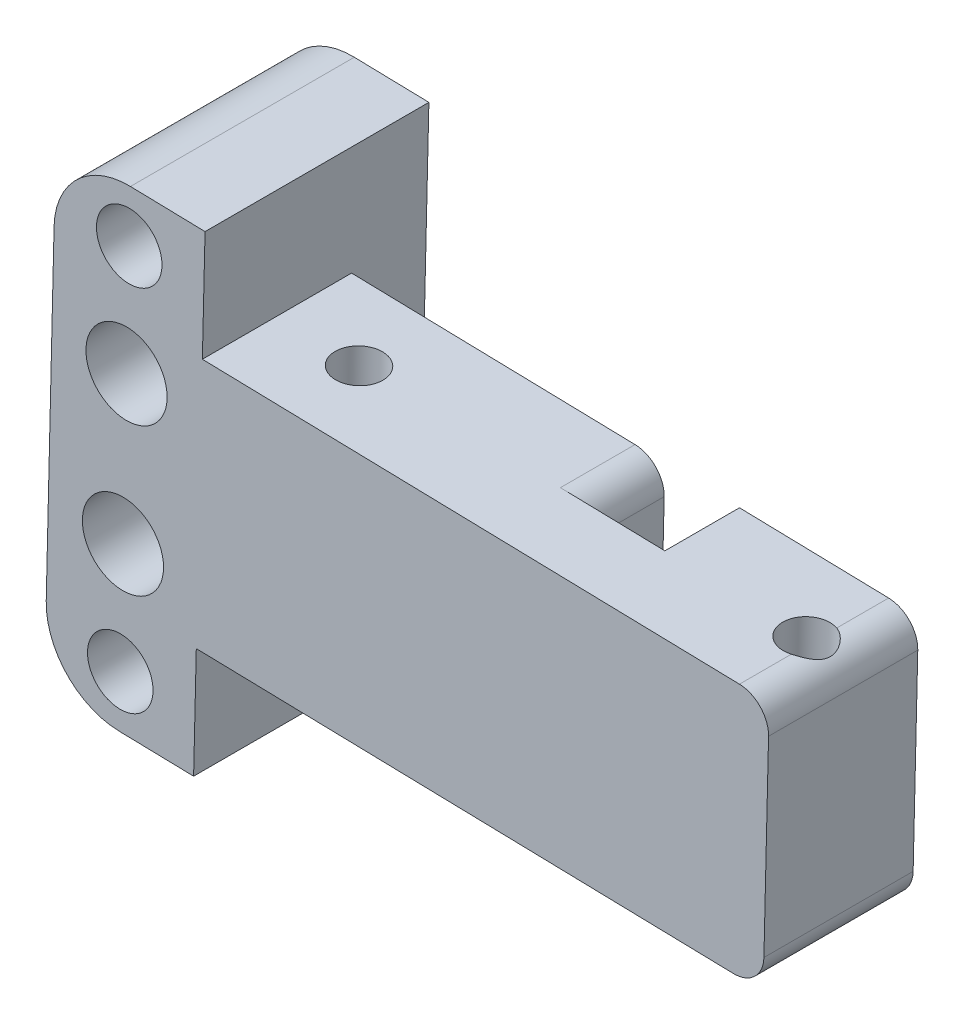
from build123d import *

# Parameters (mm, degrees)
EXTRUDE_1_DEPTH     = 15
CUT_EXTRUDE_1_DEPTH = 5
SKETCH_3_R          = 1.6
SKETCH_3_W          = 5
SKETCH_3_H          = 5
CUT_EXTRUDE_2_DEPTH = 22
FILLET_1_R          = 2


with BuildPart() as part:
    # 草图1 → 凸台-拉伸1 (new body)
    with BuildSketch(Plane.XY):
        with BuildLine():
            Line((24.185160084, -7.016301696), (24.496510845, 5.979969335))
            ThreePointArc((24.496510845, 5.979969335), (23.944762934, 7.407806858), (22.544984649, 8.027295764))
            Line((22.544984649, 8.027295764), (-13.444688974, 8.889497871))
            Line((-13.444688974, 8.889497871), (-13.265063535, 16.387346543))
            Line((-13.265063535, 16.387346543), (-18.263629316, 16.507096835))
            ThreePointArc((-18.263629316, 16.507096835), (-21.833223125, 15.127727058), (-23.38194539, 11.628281347))
            Line((-23.38194539, 11.628281347), (-23.908846678, -10.36540809))
            ThreePointArc((-23.908846678, -10.36540809), (-22.5294769, -13.935001898), (-19.030031189, -15.483724163))
            Line((-19.030031189, -15.483724163), (-14.031465408, -15.603474456))
            Line((-14.031465408, -15.603474456), (-13.851839969, -8.105625784))
            Line((-13.851839969, -8.105625784), (22.137833654, -8.967827891))
            ThreePointArc((22.137833654, -8.967827891), (23.565671178, -8.41607998), (24.185160084, -7.016301696))
        make_face()
        with BuildLine():
            ThreePointArc((-16.75044735, -12.037331753), (-18.893602347, -9.788969482), (-21.141964619, -11.93212448))
            ThreePointArc((-21.141964619, -11.93212448), (-18.998809621, -14.180486751), (-16.75044735, -12.037331753))
        make_face(mode=Mode.SUBTRACT)
        with BuildLine():
            ThreePointArc((-16.04728092, -4.552025517), (-18.701434473, -1.76757982), (-21.48588017, -4.421733373))
            ThreePointArc((-21.48588017, -4.421733373), (-18.831726617, -7.20617907), (-16.04728092, -4.552025517))
        make_face(mode=Mode.SUBTRACT)
        with BuildLine():
            ThreePointArc((-15.807780335, 5.445106045), (-18.461933888, 8.229551742), (-21.246379585, 5.575398189))
            ThreePointArc((-21.246379585, 5.575398189), (-18.592226032, 2.790952492), (-15.807780335, 5.445106045))
        make_face(mode=Mode.SUBTRACT)
        with BuildLine():
            ThreePointArc((-16.151695887, 12.955497152), (-18.294850884, 15.203859423), (-20.543213156, 13.060704426))
            ThreePointArc((-20.543213156, 13.060704426), (-18.400058158, 10.812342154), (-16.151695887, 12.955497152))
        make_face(mode=Mode.SUBTRACT)
    extrude(amount=-EXTRUDE_1_DEPTH)

    # 草图2 → 切除-拉伸1 (cut)
    with BuildSketch(Plane(origin=(0, 0, -15), x_dir=(-1, 0, 0), z_dir=(0, 0, -1))):
        Polygon((13.444688974, 8.889497871), (13.851839969, -8.105625784), (-33.415838559, -15.121344773), (-27.379501609, 15.743180277), align=None)
    extrude(amount=-CUT_EXTRUDE_1_DEPTH, mode=Mode.SUBTRACT)

    # 草图3 → 切除-拉伸2 (cut)
    with BuildSketch(Plane(origin=(0.205130979, 8.562490084, 0), x_dir=(0.9997131562086496, -0.02395005852477245, 0), z_dir=(0.02395005852477245, 0.9997131562086496, 0))):
        with Locations(Location((21.846263557, 5, 0), (0, 0, 288.209956864))):
            Circle(SKETCH_3_R)
        with Locations(Location((-8.153736443, 5, 0), (0, 0, 180))):
            Circle(SKETCH_3_R)
        with Locations((9.846263557, 7.5)):
            Rectangle(SKETCH_3_W, SKETCH_3_H)
    extrude(amount=-CUT_EXTRUDE_2_DEPTH, mode=Mode.SUBTRACT)

    # 圆角1
    fillet_1_edges = [part.edges().sort_by_distance(p)[0] for p in [
        (7.142136311, -8.608577013, -7.5),
        (7.549287306, 8.386546642, -7.5),
    ]]
    fillet(fillet_1_edges, radius=FILLET_1_R)


solid = part.part
